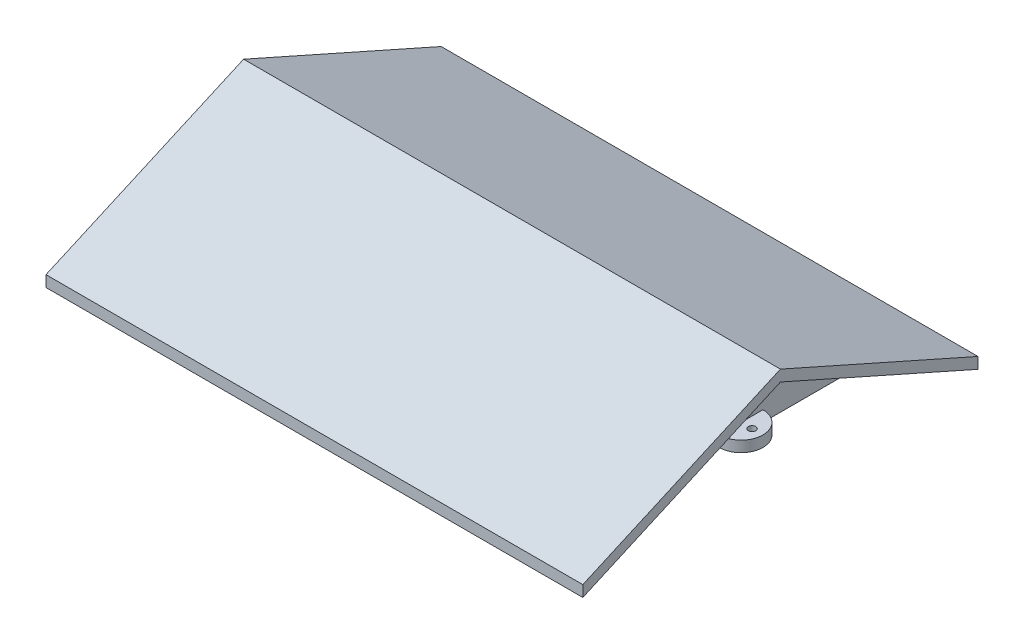
from build123d import *

# Parameters (mm, degrees)
BOSS_EXTRUDE1_DEPTH      = 0.0001
BOSS_EXTRUDE1_DEPTH_BACK = 248
BOSS_EXTRUDE2_DEPTH      = 25
CUT_EXTRUDE1_DEPTH       = 20
BOSS_EXTRUDE3_DEPTH      = 25
CUT_EXTRUDE2_DEPTH       = 20
BOSS_EXTRUDE4_DEPTH      = 5
BOSS_EXTRUDE5_DEPTH      = 5
SKETCH8_R                = 1.5
CUT_EXTRUDE3_DEPTH       = 10
SKETCH9_W                = 70
SKETCH9_H                = 5.120472302
BOSS_EXTRUDE7_DEPTH      = 250
SKETCH11_W               = 70
SKETCH11_H               = 5.120472302
CUT_EXTRUDE4_DEPTH       = 250
CUT_EXTRUDE5_DEPTH       = 2


with BuildPart() as part:
    # Sketch1 → Boss-Extrude1 (new, two sides: drawn at the far end of the back side and taken through both)
    with BuildSketch(Plane(origin=(0, 0, 0), x_dir=(0, 0, -1), z_dir=(1, 0, 0)).offset(-BOSS_EXTRUDE1_DEPTH_BACK)):
        Polygon((-23.04212536, -5.120472302), (67.5, 35.120472302), (158.04212536, -5.120472302), (158.04212536, -10.240944604), (135, 0), (67.5, 30), (0, 0), (-23.04212536, -10.240944604), align=None)
    extrude(amount=BOSS_EXTRUDE1_DEPTH + BOSS_EXTRUDE1_DEPTH_BACK)

    # Sketch2 → Boss-Extrude2 (add)
    with BuildSketch(Plane(origin=(0.0001, 0, 0), x_dir=(0, 0, -1), z_dir=(1, 0, 0))):
        Polygon((0, 0), (135, 0), (67.5, 30), align=None)
    extrude(amount=-BOSS_EXTRUDE2_DEPTH)

    # Sketch3 → Cut-Extrude1 (cut)
    with BuildSketch(Plane(origin=(0.0001, 0, 0), x_dir=(0, 0, -1), z_dir=(1, 0, 0))):
        Polygon((0, 0), (135, 0), (67.5, 30), align=None)
    extrude(amount=-CUT_EXTRUDE1_DEPTH, mode=Mode.SUBTRACT)

    # Sketch4 → Boss-Extrude3 (add)
    with BuildSketch(Plane.ZY.offset(248)):
        Polygon((-135, 0), (0, 0), (-67.5, 30), align=None)
    extrude(amount=-BOSS_EXTRUDE3_DEPTH)

    # Sketch5 → Cut-Extrude2 (cut)
    with BuildSketch(Plane.ZY.offset(248)):
        Polygon((-135, 0), (0, 0), (-67.5, 29.582678365), align=None)
    extrude(amount=-CUT_EXTRUDE2_DEPTH, mode=Mode.SUBTRACT)

    # Sketch6 → Boss-Extrude4 (add)
    with BuildSketch(Plane(origin=(0, 0, 0), x_dir=(-1, 0, 0), z_dir=(0, -1, 0))):
        with BuildLine():
            ThreePointArc((233.3, 67.5), (235, 69.2), (236.7, 67.5))
            Line((236.7, 67.5), (242, 67.5))
            ThreePointArc((242, 67.5), (237.899494937, 77.399494937), (228, 81.5))
            Line((228, 81.5), (228, 67.5))
            Line((228, 67.5), (233.3, 67.5))
        make_face()
        with BuildLine():
            Line((242, 67.5), (236.7, 67.5))
            ThreePointArc((236.7, 67.5), (235, 65.8), (233.3, 67.5))
            Line((233.3, 67.5), (228, 67.5))
            Line((228, 67.5), (228, 53.5))
            ThreePointArc((228, 53.5), (237.899494937, 57.600505063), (242, 67.5))
        make_face()
        with BuildLine():
            Line((223, 54.423303169), (223, 80.576696831))
            ThreePointArc((223, 80.576696831), (214, 67.5), (223, 54.423303169))
        make_face()
        with BuildLine():
            Line((228, 67.5), (228, 81.5))
            ThreePointArc((228, 81.5), (225.457732865, 81.267239295), (223, 80.576696831))
            Line((223, 80.576696831), (223, 54.423303169))
            ThreePointArc((223, 54.423303169), (225.457732865, 53.732760705), (228, 53.5))
            Line((228, 53.5), (228, 67.5))
        make_face()
    extrude(amount=-BOSS_EXTRUDE4_DEPTH)

    # Sketch7 → Boss-Extrude5 (add)
    with BuildSketch(Plane(origin=(0, 0, 0), x_dir=(-1, 0, 0), z_dir=(0, -1, 0))):
        with BuildLine():
            Line((19.9999, 57.5001), (19.9999, 67.5))
            Line((19.9999, 67.5), (16.69995, 67.5))
            ThreePointArc((16.69995, 67.5), (14.99995, 65.8), (13.29995, 67.5))
            Line((13.29995, 67.5), (10, 67.5))
            ThreePointArc((10, 67.5), (12.928902899, 60.429002899), (19.9999, 57.5001))
        make_face()
        with BuildLine():
            Line((16.69995, 67.5), (19.9999, 67.5))
            Line((19.9999, 67.5), (19.9999, 77.4999))
            ThreePointArc((19.9999, 77.4999), (12.928902899, 74.570997101), (10, 67.5))
            Line((10, 67.5), (13.29995, 67.5))
            ThreePointArc((13.29995, 67.5), (14.99995, 69.2), (16.69995, 67.5))
        make_face()
        with BuildLine():
            Line((19.9999, 77.4999), (19.9999, 67.5))
            Line((19.9999, 67.5), (19.9999, 57.5001))
            ThreePointArc((19.9999, 57.5001), (22.588092453, 57.840845801), (24.9999, 58.839861432))
            Line((24.9999, 58.839861432), (24.9999, 76.160138568))
            ThreePointArc((24.9999, 76.160138568), (22.588092453, 77.159154199), (19.9999, 77.4999))
        make_face()
        with BuildLine():
            ThreePointArc((29.9998, 67.5), (28.660081869, 72.499925), (24.9999, 76.160138568))
            Line((24.9999, 76.160138568), (24.9999, 58.839861432))
            ThreePointArc((24.9999, 58.839861432), (28.660081869, 62.500075), (29.9998, 67.5))
        make_face()
    extrude(amount=-BOSS_EXTRUDE5_DEPTH)

    # Sketch8 → Cut-Extrude3 (cut)
    with BuildSketch(Plane.ZY.offset(228)):
        with Locations((-67.5, 25)):
            Circle(SKETCH8_R)
    extrude(amount=-CUT_EXTRUDE3_DEPTH, mode=Mode.SUBTRACT)

    # Sketch9 → Boss-Extrude7 (add)
    with BuildSketch(Plane.ZY.offset(248)):
        with Locations((58.04212536, -7.680708453)):
            Rectangle(SKETCH9_W, SKETCH9_H)
    extrude(amount=-BOSS_EXTRUDE7_DEPTH)

    # Sketch11 → Cut-Extrude4 (cut)
    with BuildSketch(Plane.ZY.offset(248)):
        with Locations((58.04212536, -7.680708453)):
            Rectangle(SKETCH11_W, SKETCH11_H)
    extrude(amount=-CUT_EXTRUDE4_DEPTH, mode=Mode.SUBTRACT)

    # Sketch12 → Cut-Extrude5 (cut)
    with BuildSketch(Plane(origin=(0.0001, 0, 0), x_dir=(0, 0, -1), z_dir=(1, 0, 0))):
        Polygon((-23.04212536, -5.120472302), (67.5, 35.120472302), (158.04212536, -5.120472302), (158.04212536, -10.240944604), (67.5, 30), (-23.04212536, -10.240944604), align=None)
    extrude(amount=-CUT_EXTRUDE5_DEPTH, mode=Mode.SUBTRACT)


solid = part.part
